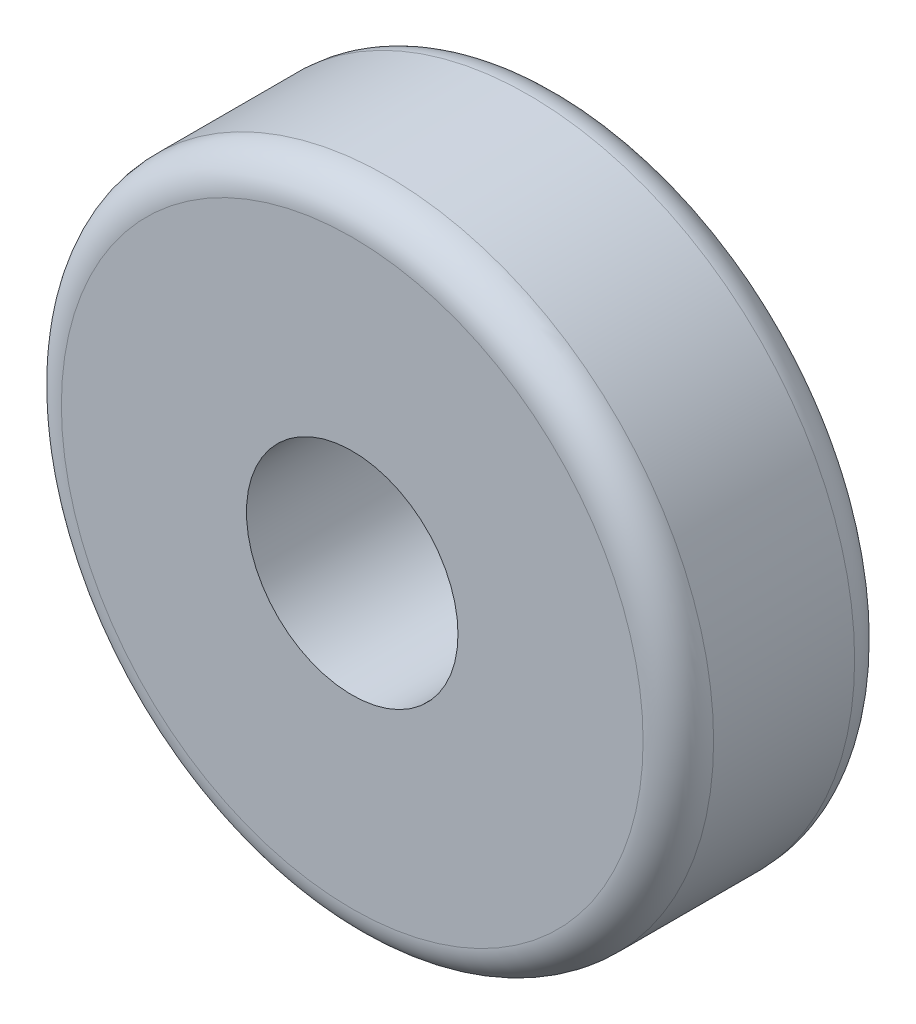
from build123d import *

# Parameters (mm, degrees)
SKETCH_1_R      = 18.5
SKETCH_1_R_2    = 6
EXTRUDE_1_DEPTH = 12
FILLET_1_R      = 2
FILLET_2_R      = 2


with BuildPart() as part:
    # 草图1 → 拉伸1 (new body)
    with BuildSketch(Plane.XY):
        Circle(SKETCH_1_R)
        Circle(SKETCH_1_R_2, mode=Mode.SUBTRACT)
    extrude(amount=EXTRUDE_1_DEPTH)

    # 圆角1
    fillet_1_edges = [part.edges().sort_by_distance(p)[0] for p in [
        (-18.5, 0, 12),
    ]]
    fillet(fillet_1_edges, radius=FILLET_1_R)

    # 圆角2
    fillet_2_edges = [part.edges().sort_by_distance(p)[0] for p in [
        (-18.5, 0, 0),
    ]]
    fillet(fillet_2_edges, radius=FILLET_2_R)


solid = part.part
